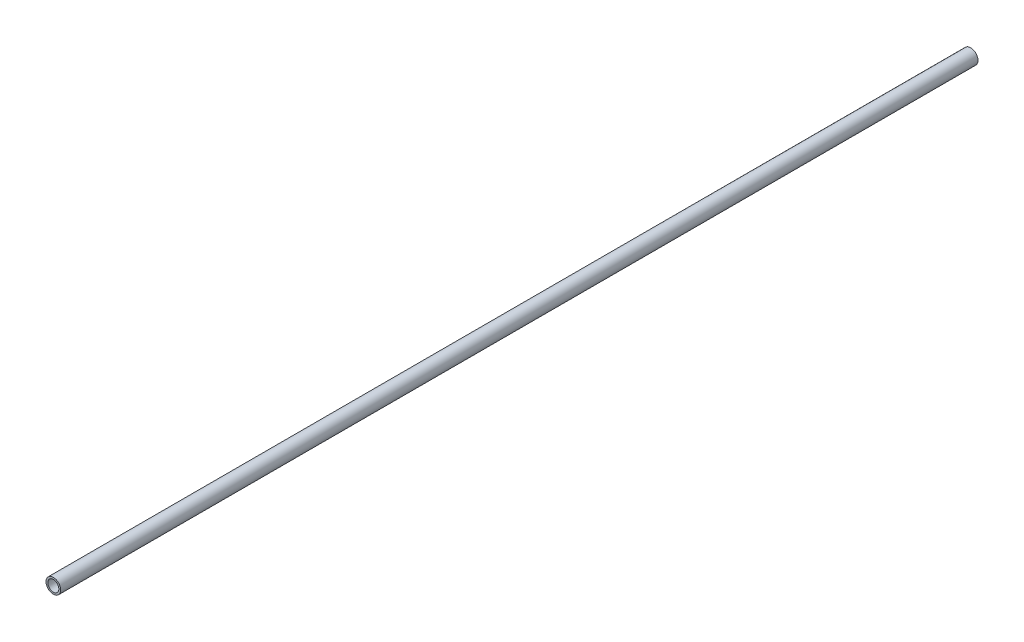
from build123d import *

# Parameters (mm, degrees)
SZKIC1_R                    = 4
DODANIE_WYCI_GNI_CIE1_DEPTH = 500
SZKIC2_R                    = 3
WYTNIJ_WYCI_GNI_CIE1_DEPTH  = 500


with BuildPart() as part:
    # Szkic1 → Dodanie-wyciągnięcie1 (new body)
    with BuildSketch(Plane.XY):
        Circle(SZKIC1_R)
    extrude(amount=DODANIE_WYCI_GNI_CIE1_DEPTH)

    # Szkic2 → Wytnij-wyciągnięcie1 (cut)
    with BuildSketch(Plane.XY.offset(500)):
        Circle(SZKIC2_R)
    extrude(amount=-WYTNIJ_WYCI_GNI_CIE1_DEPTH, mode=Mode.SUBTRACT)


solid = part.part
